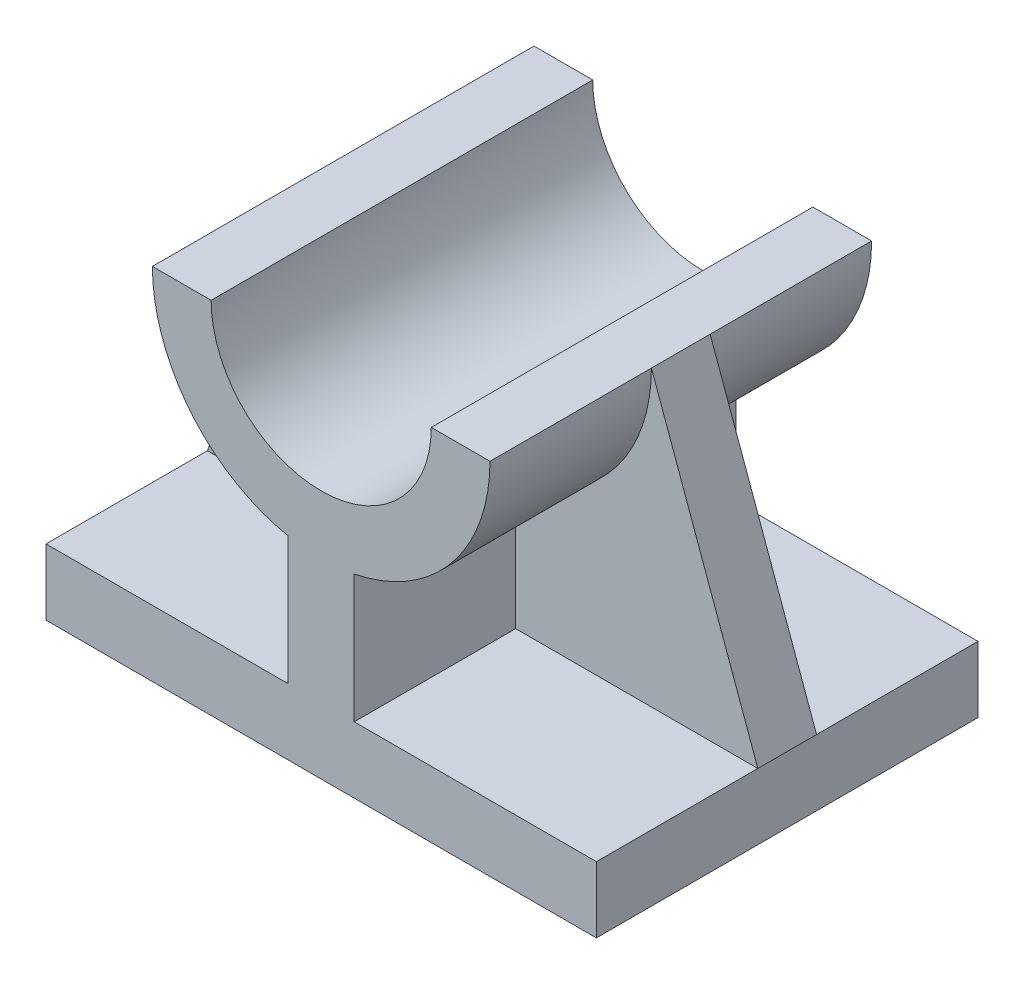
from build123d import *

# Parameters (mm, degrees)
BOSS_EXTRUDE1_DEPTH = 26
RIB11_REACH         = 65.738
SKETCH2_WALL_W      = 172.022520638
SKETCH2_WALL_H      = 8


with BuildPart() as part:
    # Sketch1 → Boss-Extrude1 (new, symmetric)
    with BuildSketch(Plane.XY):
        with BuildLine():
            Line((-23, 44.5), (-15, 44.5))
            ThreePointArc((-15, 44.5), (0, 29.5), (15, 44.5))
            Line((15, 44.5), (23, 44.5))
            ThreePointArc((23, 44.5), (17.783419244, 29.914047854), (4.5, 21.944512863))
            Line((4.5, 21.944512863), (4.5, 4.5))
            Line((4.5, 4.5), (37.5, 4.5))
            Line((37.5, 4.5), (37.5, -4.5))
            Line((37.5, -4.5), (-37.5, -4.5))
            Line((-37.5, -4.5), (-37.5, 4.5))
            Line((-37.5, 4.5), (-4.5, 4.5))
            Line((-4.5, 4.5), (-4.5, 21.944512863))
            ThreePointArc((-4.5, 21.944512863), (-17.783419244, 29.914047854), (-23, 44.5))
        make_face()
    extrude(amount=BOSS_EXTRUDE1_DEPTH, both=True)

    # Sketch2 wall → Rib11 (add, up to next)
    with BuildSketch(Plane(origin=(30.25, 24.5, 0), x_dir=(0.340799323621, -0.940136065162, 0), z_dir=(0.940136065162, 0.340799323621, 0)), mode=Mode.PRIVATE) as rib11_sk1:
        Rectangle(SKETCH2_WALL_W, SKETCH2_WALL_H)
    rib11_tool1 = extrude(rib11_sk1.sketch, amount=-RIB11_REACH, mode=Mode.PRIVATE) - part.part
    rib11 = rib11_tool1.solids().sort_by_distance((30.25, 24.5, 0))[0]
    add(rib11)

    # Mirror1: Rib11 across plane
    add(rib11.mirror(Plane(origin=(0, 0, 0), x_dir=(0, 0, 1), z_dir=(1, 0, 0))))


solid = part.part
